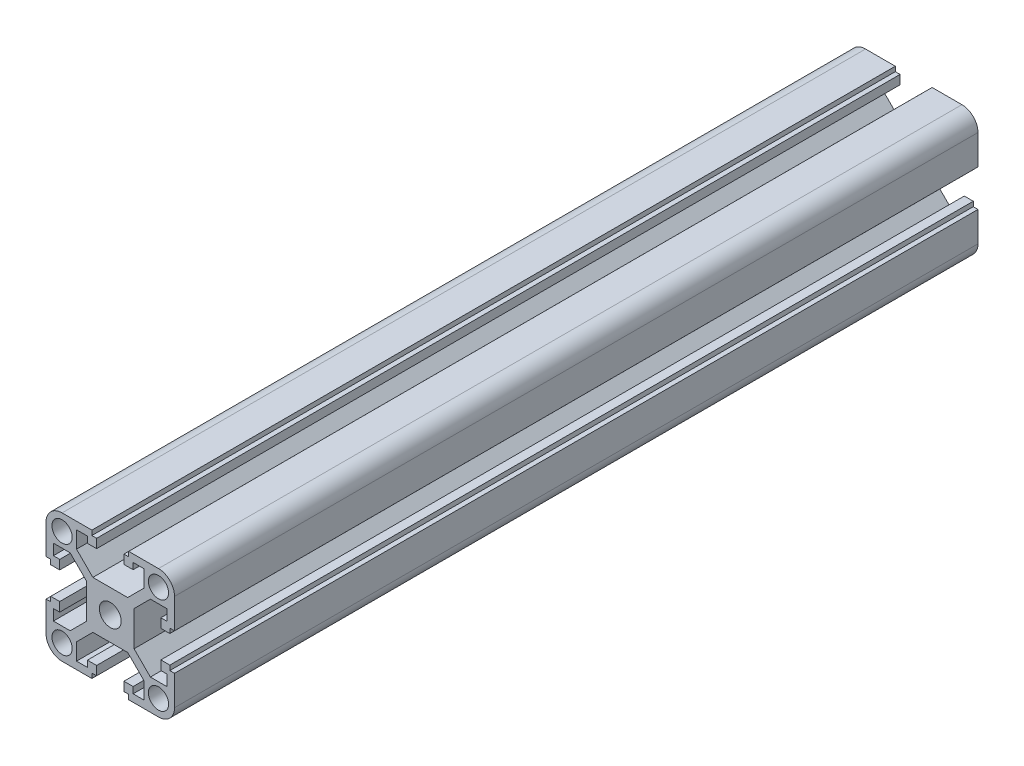
from build123d import *

# Parameters (mm, degrees)
SKETCH_1_R      = 3.4
SKETCH_1_R_2    = 3.15
EXTRUDE_1_DEPTH = 125


with BuildPart() as part:
    # Эскиз1 → Бобышка-Вытянуть1 (new, symmetric)
    with BuildSketch(Plane.XY):
        with BuildLine():
            Line((-15, 20), (-5.727351849, 20))
            Line((-5.727351849, 20), (-5.727351849, 18.530416438))
            Line((-5.727351849, 18.530416438), (-4.25, 18.530416438))
            Line((-4.25, 18.530416438), (-4.25, 15.732027397))
            Line((-4.25, 15.732027397), (-7.111831817, 15.732027397))
            Line((-7.111831817, 15.732027397), (-7.111831817, 17.7))
            Line((-7.111831817, 17.7), (-10.5, 17.7))
            Line((-10.5, 17.7), (-10.5, 12.479898987))
            Line((-10.5, 12.479898987), (-5.420101013, 7.4))
            Line((-5.420101013, 7.4), (5.420101013, 7.4))
            Line((5.420101013, 7.4), (10.5, 12.479898987))
            Line((10.5, 12.479898987), (10.5, 17.7))
            Line((10.5, 17.7), (7.111831817, 17.7))
            Line((7.111831817, 17.7), (7.111831817, 15.732027397))
            Line((7.111831817, 15.732027397), (4.25, 15.732027397))
            Line((4.25, 15.732027397), (4.25, 18.530416438))
            Line((4.25, 18.530416438), (5.727351849, 18.530416438))
            Line((5.727351849, 18.530416438), (5.727351849, 20))
            Line((5.727351849, 20), (15, 20))
            ThreePointArc((15, 20), (18.535533906, 18.535533906), (20, 15))
            Line((20, 15), (20, 5.727351849))
            Line((20, 5.727351849), (18.530416438, 5.727351849))
            Line((18.530416438, 5.727351849), (18.530416438, 4.25))
            Line((18.530416438, 4.25), (15.732027397, 4.25))
            Line((15.732027397, 4.25), (15.732027397, 7.111831817))
            Line((15.732027397, 7.111831817), (17.7, 7.111831817))
            Line((17.7, 7.111831817), (17.7, 10.5))
            Line((17.7, 10.5), (12.479898987, 10.5))
            Line((12.479898987, 10.5), (7.4, 5.420101013))
            Line((7.4, 5.420101013), (7.4, -5.420101013))
            Line((7.4, -5.420101013), (12.479898987, -10.5))
            Line((12.479898987, -10.5), (17.7, -10.5))
            Line((17.7, -10.5), (17.7, -7.111831817))
            Line((17.7, -7.111831817), (15.732027397, -7.111831817))
            Line((15.732027397, -7.111831817), (15.732027397, -4.25))
            Line((15.732027397, -4.25), (18.530416438, -4.25))
            Line((18.530416438, -4.25), (18.530416438, -5.727351849))
            Line((18.530416438, -5.727351849), (20, -5.727351849))
            Line((20, -5.727351849), (20, -15))
            ThreePointArc((20, -15), (18.535533906, -18.535533906), (15, -20))
            Line((15, -20), (5.727351849, -20))
            Line((5.727351849, -20), (5.727351849, -18.530416438))
            Line((5.727351849, -18.530416438), (4.25, -18.530416438))
            Line((4.25, -18.530416438), (4.25, -15.732027397))
            Line((4.25, -15.732027397), (7.111831817, -15.732027397))
            Line((7.111831817, -15.732027397), (7.111831817, -17.7))
            Line((7.111831817, -17.7), (10.5, -17.7))
            Line((10.5, -17.7), (10.5, -12.479898987))
            Line((10.5, -12.479898987), (5.420101013, -7.4))
            Line((5.420101013, -7.4), (-5.420101013, -7.4))
            Line((-5.420101013, -7.4), (-10.5, -12.479898987))
            Line((-10.5, -12.479898987), (-10.5, -17.7))
            Line((-10.5, -17.7), (-7.111831817, -17.7))
            Line((-7.111831817, -17.7), (-7.111831817, -15.732027397))
            Line((-7.111831817, -15.732027397), (-4.25, -15.732027397))
            Line((-4.25, -15.732027397), (-4.25, -18.530416438))
            Line((-4.25, -18.530416438), (-5.727351849, -18.530416438))
            Line((-5.727351849, -18.530416438), (-5.727351849, -20))
            Line((-5.727351849, -20), (-15, -20))
            ThreePointArc((-15, -20), (-18.535533906, -18.535533906), (-20, -15))
            Line((-20, -15), (-20, -5.727351849))
            Line((-20, -5.727351849), (-18.530416438, -5.727351849))
            Line((-18.530416438, -5.727351849), (-18.530416438, -4.25))
            Line((-18.530416438, -4.25), (-15.732027397, -4.25))
            Line((-15.732027397, -4.25), (-15.732027397, -7.111831817))
            Line((-15.732027397, -7.111831817), (-17.7, -7.111831817))
            Line((-17.7, -7.111831817), (-17.7, -10.5))
            Line((-17.7, -10.5), (-12.479898987, -10.5))
            Line((-12.479898987, -10.5), (-7.4, -5.420101013))
            Line((-7.4, -5.420101013), (-7.4, 5.420101013))
            Line((-7.4, 5.420101013), (-12.479898987, 10.5))
            Line((-12.479898987, 10.5), (-17.7, 10.5))
            Line((-17.7, 10.5), (-17.7, 7.111831817))
            Line((-17.7, 7.111831817), (-15.732027397, 7.111831817))
            Line((-15.732027397, 7.111831817), (-15.732027397, 4.25))
            Line((-15.732027397, 4.25), (-18.530416438, 4.25))
            Line((-18.530416438, 4.25), (-18.530416438, 5.727351849))
            Line((-18.530416438, 5.727351849), (-20, 5.727351849))
            Line((-20, 5.727351849), (-20, 15))
            ThreePointArc((-20, 15), (-18.535533906, 18.535533906), (-15, 20))
        make_face()
        Circle(SKETCH_1_R, mode=Mode.SUBTRACT)
        with Locations((-15, 15)):
            Circle(SKETCH_1_R_2, mode=Mode.SUBTRACT)
        with Locations((15, 15)):
            Circle(SKETCH_1_R_2, mode=Mode.SUBTRACT)
        with Locations((15, -15)):
            Circle(SKETCH_1_R_2, mode=Mode.SUBTRACT)
        with Locations((-15, -15)):
            Circle(SKETCH_1_R_2, mode=Mode.SUBTRACT)
    extrude(amount=EXTRUDE_1_DEPTH, both=True)


solid = part.part
